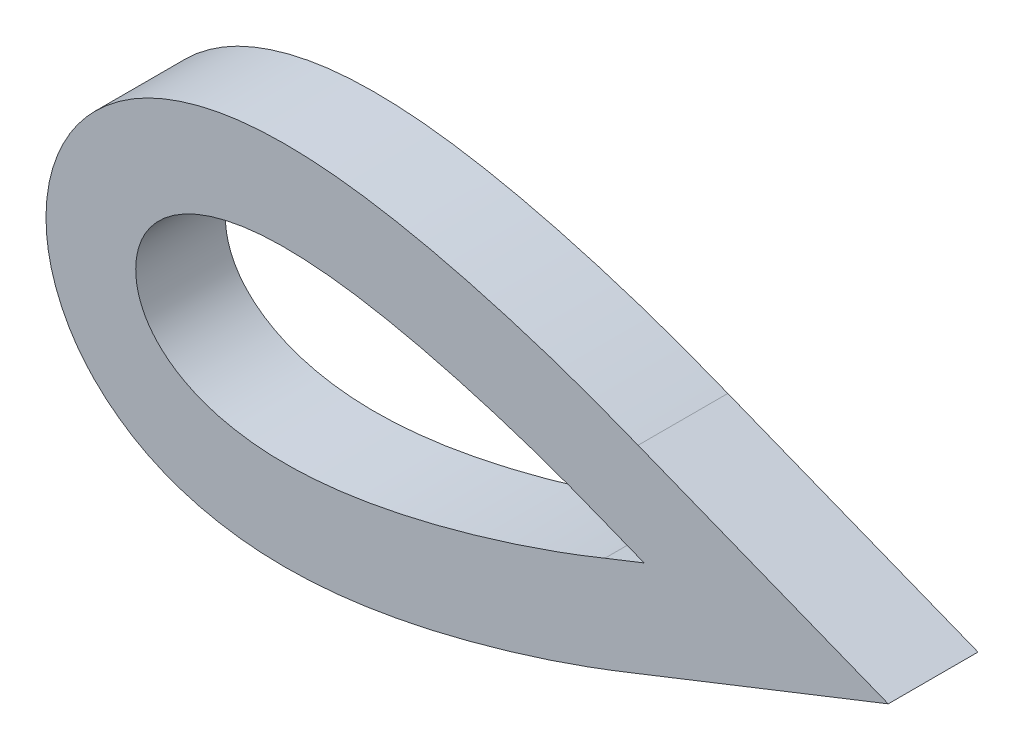
from build123d import *

# Parameters (mm, degrees)
BOSS_EXTRUDE1_DEPTH = 3


with BuildPart() as part:
    # Sketch2 → Boss-Extrude1 (new body)
    with BuildSketch(Plane.XY):
        with BuildLine():
            Line((16.29653982, -3.306307237), (24.660737915, 0))
            Line((24.660737915, 0), (16.29653982, 3.306307237))
            add(Edge.make_bspline(
                [(16.29653982, 3.306307237), (15.606253192, 3.58341901), (14.217393724, 4.114068767), (12.087183213, 4.803666628), (9.91285023, 5.399905044), (7.639008505, 5.880494652), (5.579359459, 6.128628145), (3.768494119, 6.132761481), (2.305635804, 5.980169092), (0.698738216, 5.5722201), (-0.754528623, 4.872356549), (-1.940461109, 3.878627219), (-2.759806506, 2.854492965), (-3.368768122, 1.472930609), (-3.565615939, 0), (-3.368768122, -1.472930609), (-2.759806506, -2.854492965), (-1.940461109, -3.878627219), (-0.754528623, -4.872356549), (0.698738216, -5.5722201), (2.305635804, -5.980169092), (3.768494119, -6.132761481), (5.579359459, -6.128628145), (7.639008505, -5.880494652), (9.91285023, -5.399905044), (12.087183213, -4.803666628), (14.217393724, -4.114068767), (15.606253192, -3.58341901), (16.29653982, -3.306307237)],
                knots=[0.000239228, 0.000239228, 0.000239228, 0.000239228, 0.062709325, 0.125179421, 0.187649518, 0.250119614, 0.312589711, 0.343824759, 0.375059807, 0.406294855, 0.437529904, 0.453147428, 0.468764952, 0.484382476, 0.5, 0.515617524, 0.531235048, 0.546852572, 0.562470096, 0.593705145, 0.624940193, 0.656175241, 0.687410289, 0.749880386, 0.812350482, 0.874820579, 0.937290675, 0.999760772, 0.999760772, 0.999760772, 0.999760772], degree=3))
        make_face()
        with BuildLine():
            Line((15.186280609, -0.519303809), (16.5, 0))
            Line((16.5, 0), (15.186280609, 0.519303809))
            add(Edge.make_bspline(
                [(15.186280609, 0.519303809), (14.865020619, 0.64827798), (14.53925074, 0.778688361), (13.882708658, 1.027688026), (13.553773507, 1.147139713), (12.562781304, 1.494833182), (11.897000085, 1.711387351), (10.554968454, 2.112961285), (9.878759656, 2.298271745), (8.513141408, 2.628749598), (7.823700522, 2.774227212), (6.426212203, 3.003466273), (5.717502113, 3.087360402), (4.280183907, 3.143912253), (3.549768986, 3.118686872), (2.455105262, 2.920121324), (2.089505542, 2.826315674), (1.373444248, 2.557840121), (1.022717937, 2.384583024), (0.370973091, 1.917274323), (0.070074949, 1.621964912), (-0.262454461, 1.067800533), (-0.351329953, 0.863359624), (-0.469181936, 0.440955488), (-0.5, 0.221471168), (-0.5, -0.221471168), (-0.469181936, -0.440955488), (-0.351329953, -0.863359624), (-0.262454461, -1.067800533), (0.070074949, -1.621964912), (0.370973091, -1.917274323), (1.022717937, -2.384583024), (1.373444248, -2.557840121), (2.089505542, -2.826315674), (2.455105262, -2.920121324), (3.549768986, -3.118686872), (4.280183907, -3.143912253), (5.717502113, -3.087360402), (6.426212203, -3.003466273), (7.823700522, -2.774227212), (8.513141408, -2.628749598), (9.878759656, -2.298271745), (10.554968454, -2.112961285), (11.897000085, -1.711387351), (12.562781304, -1.494833182), (13.553773507, -1.147139713), (13.882708658, -1.027688026), (14.53925074, -0.778688361), (14.865020619, -0.64827798), (15.186280609, -0.519303809)],
                knots=[0, 0, 0, 0, 0.03125, 0.03125, 0.0625, 0.0625, 0.125, 0.125, 0.1875, 0.1875, 0.25, 0.25, 0.3125, 0.3125, 0.375, 0.375, 0.40625, 0.40625, 0.4375, 0.4375, 0.46875, 0.46875, 0.484375, 0.484375, 0.5, 0.5, 0.515625, 0.515625, 0.53125, 0.53125, 0.5625, 0.5625, 0.59375, 0.59375, 0.625, 0.625, 0.6875, 0.6875, 0.75, 0.75, 0.8125, 0.8125, 0.875, 0.875, 0.9375, 0.9375, 0.96875, 0.96875, 1, 1, 1, 1], degree=3))
        make_face(mode=Mode.SUBTRACT)
    extrude(amount=BOSS_EXTRUDE1_DEPTH)


solid = part.part
